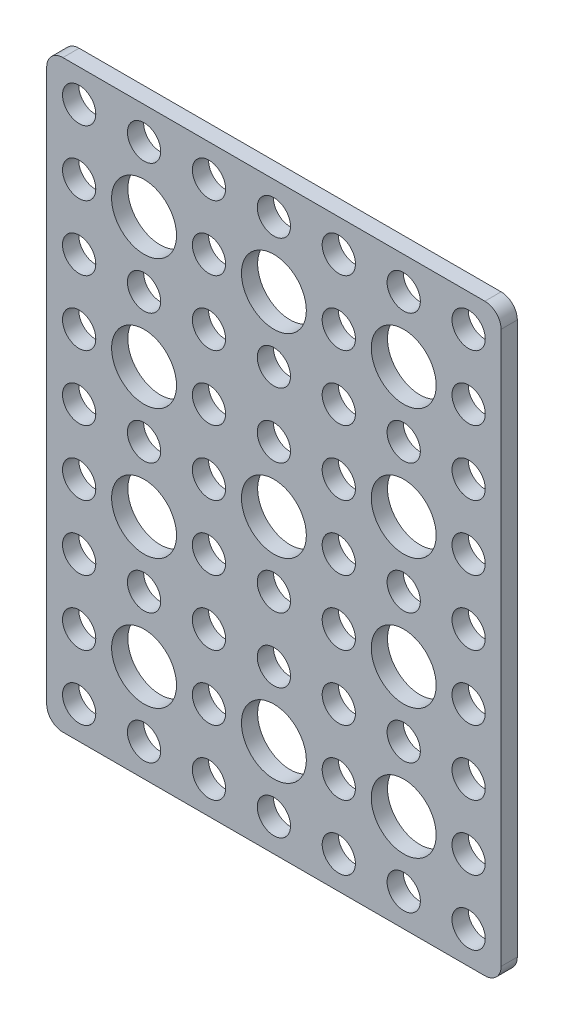
from build123d import *

# Parameters (mm, degrees)
SKETCH1_W            = 56
SKETCH1_H            = 72
BOSS_EXTRUDE1_DEPTH  = 2
SKETCH2_R            = 2.05
CUT_EXTRUDE1_DEPTH   = 92.235957824
LPATTERN1_COUNT      = 7
LPATTERN1_PITCH      = 8
LPATTERN1_COUNT_DIR2 = 9
LPATTERN1_PITCH_DIR2 = 8
FILLET1_R            = 2
SKETCH3_R            = 4
CUT_EXTRUDE2_DEPTH   = 92.235957824
LPATTERN2_COUNT      = 3
LPATTERN2_PITCH      = 16
LPATTERN2_COUNT_DIR2 = 4
LPATTERN2_PITCH_DIR2 = 16
SKETCH4_R            = 4
CUT_EXTRUDE3_DEPTH   = 92.235957824


with BuildPart() as part:
    # Sketch1 → Boss-Extrude1 (new body)
    with BuildSketch(Plane.XY):
        with Locations((28, 36)):
            Rectangle(SKETCH1_W, SKETCH1_H)
    extrude(amount=BOSS_EXTRUDE1_DEPTH)

    # Sketch2 → Cut-Extrude1 (cut, through all)
    with BuildSketch(Plane.XY.offset(2)):
        with Locations((4, 68)):
            Circle(SKETCH2_R)
    cut_extrude1 = extrude(amount=-CUT_EXTRUDE1_DEPTH, mode=Mode.SUBTRACT)

    # LPattern1: Cut-Extrude1 7 × 9, 11 skipped
    with Locations(*[(i * LPATTERN1_PITCH, -j * LPATTERN1_PITCH_DIR2, 0) for i in range(LPATTERN1_COUNT) for j in range(LPATTERN1_COUNT_DIR2) if (i, j) not in ((0, 0), (1, 1), (1, 3), (1, 5), (1, 7), (3, 1), (3, 4), (3, 7), (5, 1), (5, 3), (5, 5), (5, 7))]):
        add(cut_extrude1, mode=Mode.SUBTRACT)

    # Fillet1
    fillet1_edges = [part.edges().sort_by_distance(p)[0] for p in [
        (0, 72, 1),
        (56, 72, 1),
        (56, 0, 1),
        (0, 0, 1),
    ]]
    fillet(fillet1_edges, radius=FILLET1_R)

    # Sketch3 → Cut-Extrude2 (cut, through all)
    with BuildSketch(Plane.XY.offset(2)):
        with Locations((12, 60)):
            Circle(SKETCH3_R)
    cut_extrude2 = extrude(amount=-CUT_EXTRUDE2_DEPTH, mode=Mode.SUBTRACT)

    # LPattern2: Cut-Extrude2 3 × 4, 2 skipped
    with Locations(*[(i * LPATTERN2_PITCH, -j * LPATTERN2_PITCH_DIR2, 0) for i in range(LPATTERN2_COUNT) for j in range(LPATTERN2_COUNT_DIR2) if (i, j) not in ((0, 0), (1, 1), (1, 2))]):
        add(cut_extrude2, mode=Mode.SUBTRACT)

    # Sketch4 → Cut-Extrude3 (cut, through all)
    with BuildSketch(Plane.XY.offset(2)):
        with Locations((28, 36)):
            Circle(SKETCH4_R)
    extrude(amount=-CUT_EXTRUDE3_DEPTH, mode=Mode.SUBTRACT)


solid = part.part
